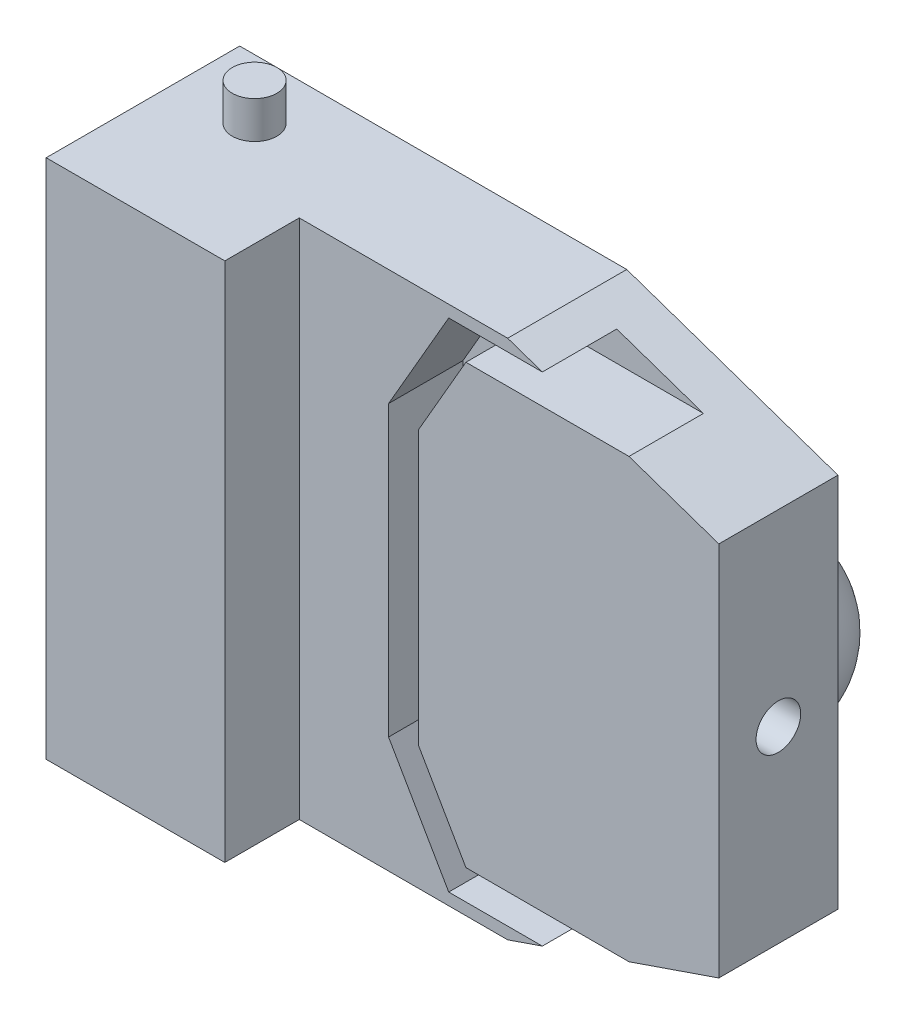
from build123d import *

# Parameters (mm, degrees)
BOSS_EXTRUDE1_DEPTH = 80
SKETCH2_R           = 15
BOSS_EXTRUDE2_DEPTH = 25
BOSS_EXTRUDE3_START = -375
SKETCH2_2_R         = 15
BOSS_EXTRUDE3_DEPTH = 25
SKETCH4_R           = 15
CUT_EXTRUDE1_DEPTH  = 30
CUT_EXTRUDE3_DEPTH  = 50
REVOLVE1_ANGLE      = 180
SKETCH6_W           = 120
SKETCH6_H           = 350
BOSS_EXTRUDE4_DEPTH = 50


with BuildPart() as part:
    # Sketch1 → Boss-Extrude1 (new body)
    with BuildSketch(Plane.XY):
        Polygon((0, 0), (-260, 0), (-260, -350), (0, -350), (141.863078537, -301.267393379), (141.863078537, -48.732606621), align=None)
    extrude(amount=BOSS_EXTRUDE1_DEPTH)

    # Sketch2 → Boss-Extrude2 (add)
    with BuildSketch(Plane.XZ.offset(350)):
        with Locations(Location((-210, 40, 0), (0, 0, 90))):
            Circle(SKETCH2_R)
    extrude(amount=BOSS_EXTRUDE2_DEPTH)

    # Sketch2<2> → Boss-Extrude3 (add)
    with BuildSketch(Plane.XZ.offset(350).offset(BOSS_EXTRUDE3_START)):
        with Locations(Location((-210, 40, 0), (0, 0, 90))):
            Circle(SKETCH2_2_R)
    extrude(amount=BOSS_EXTRUDE3_DEPTH)

    # Sketch4 → Cut-Extrude1 (cut)
    with BuildSketch(Plane(origin=(141.863078537, 0, 0), x_dir=(0, 0, -1), z_dir=(1, 0, 0))):
        with Locations((-40, -175)):
            Circle(SKETCH4_R)
    extrude(amount=-CUT_EXTRUDE1_DEPTH, mode=Mode.SUBTRACT)

    # Sketch5 → Cut-Extrude3 (cut)
    with BuildSketch(Plane.XY.offset(80)):
        Polygon((23.288403945, -342), (-39.585481157, -342), (-80, -272), (-80, -78), (-39.585481157, -8), (23.288403945, -8), (81.509413808, -28), (-28.038475773, -28), (-60, -83.358983849), (-60, -266.641016151), (-28.038475773, -322), (81.509413808, -322), align=None)
    extrude(amount=-CUT_EXTRUDE3_DEPTH, mode=Mode.SUBTRACT)

    # Sketch3 → Revolve1 (revolve)
    with BuildSketch(Plane(origin=(0, 0, 0), x_dir=(-1, 0, 0), z_dir=(0, 0, -1))):
        with BuildLine():
            Line((-11.863078537, -175), (-131.863078537, -175))
            ThreePointArc((-131.863078537, -175), (-71.863078537, -115), (-11.863078537, -175))
        make_face()
    revolve(axis=Axis((141.863078537, -175, 0), (-1, 0, 0)), revolution_arc=REVOLVE1_ANGLE)

    # Sketch6 → Boss-Extrude4 (add)
    with BuildSketch(Plane.XY.offset(80)):
        with Locations((-200, -175)):
            Rectangle(SKETCH6_W, SKETCH6_H)
    extrude(amount=BOSS_EXTRUDE4_DEPTH)


solid = part.part
